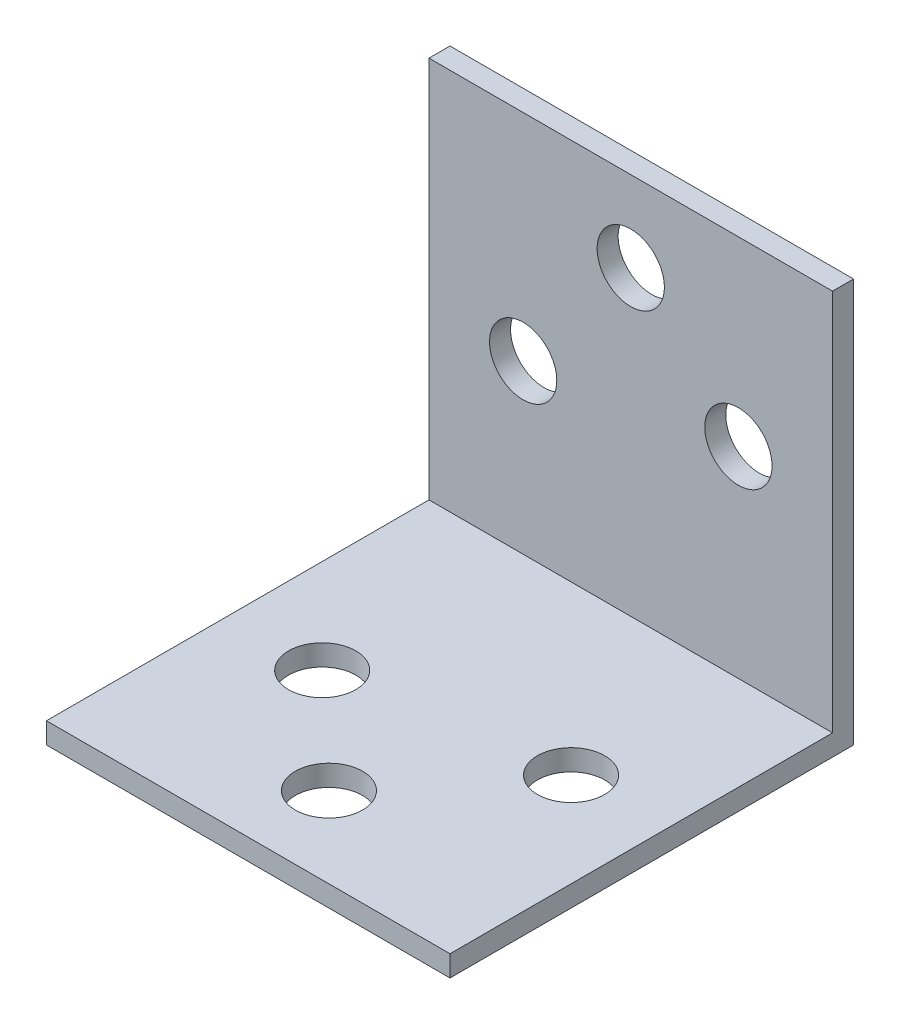
from build123d import *

# Parameters (mm, degrees)
SKETCH1_W           = 38.1
SKETCH1_H           = 38.1
SKETCH1_R           = 3.175
BOSS_EXTRUDE1_DEPTH = 1.984375
SKETCH2_W           = 38.1
SKETCH2_H           = 36.115625
SKETCH2_R           = 3.175
BOSS_EXTRUDE2_DEPTH = 1.984375


with BuildPart() as part:
    # Sketch1 → Boss-Extrude1 (new body)
    with BuildSketch(Plane(origin=(0, 0, 0), x_dir=(1, 0, 0), z_dir=(0, 1, 0))):
        with Locations((19.05, -19.05)):
            Rectangle(SKETCH1_W, SKETCH1_H)
        with Locations(Location((19.05, -30.48, 0), (0, 0, 270))):
            Circle(SKETCH1_R, mode=Mode.SUBTRACT)
        with Locations(Location((8.89, -20.955, 0), (0, 0, 270))):
            Circle(SKETCH1_R, mode=Mode.SUBTRACT)
        with Locations(Location((29.21, -17.78, 0), (0, 0, 270))):
            Circle(SKETCH1_R, mode=Mode.SUBTRACT)
    extrude(amount=BOSS_EXTRUDE1_DEPTH)

    # Sketch2 → Boss-Extrude2 (add)
    with BuildSketch(Plane.XY):
        with Locations((19.05, 20.0421875)):
            Rectangle(SKETCH2_W, SKETCH2_H)
        with Locations((19.05, 30.48)):
            Circle(SKETCH2_R, mode=Mode.SUBTRACT)
        with Locations((8.89, 17.78)):
            Circle(SKETCH2_R, mode=Mode.SUBTRACT)
        with Locations((29.21, 20.955)):
            Circle(SKETCH2_R, mode=Mode.SUBTRACT)
    extrude(amount=BOSS_EXTRUDE2_DEPTH)


solid = part.part
